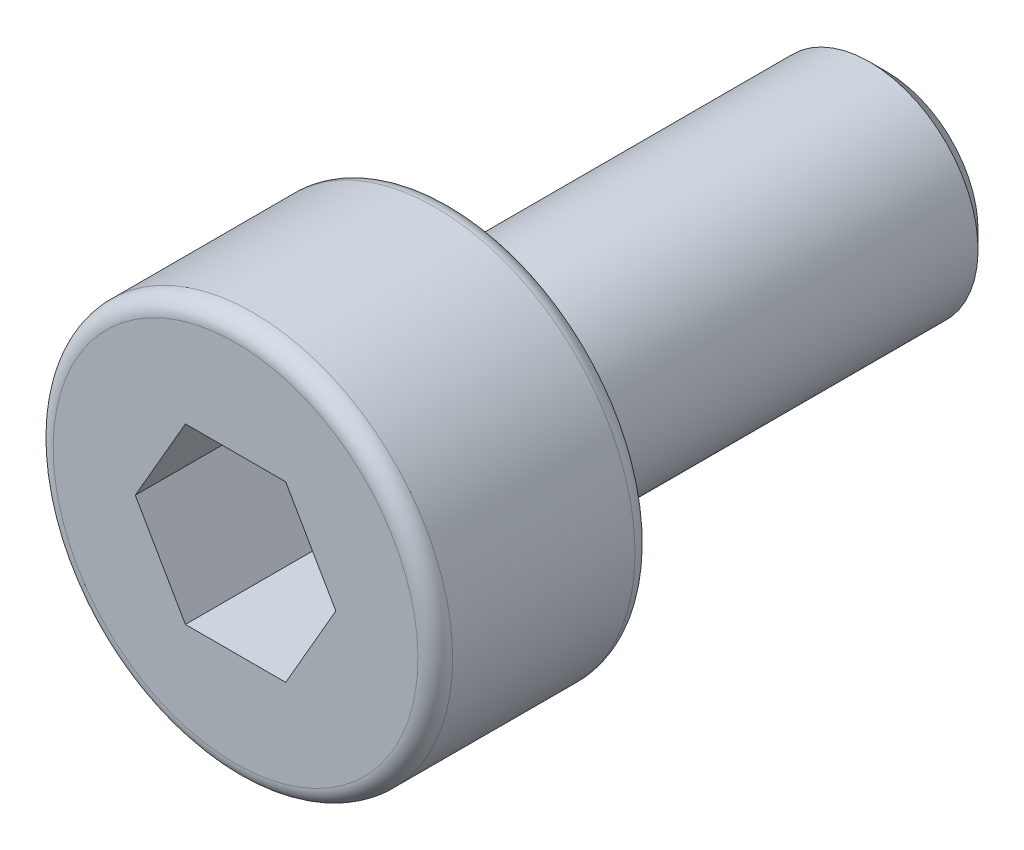
from build123d import *

# Parameters (mm, degrees)
FILLET_1_R          = 0.2
CHAMFER_1_SIZE      = 0.2
CUT_EXTRUDE_1_DEPTH = 1.5


with BuildPart() as part:
    # 草图2 → 旋转1 (revolve)
    with BuildSketch(Plane(origin=(0, 0, 0), x_dir=(0, 0, -1), z_dir=(1, 0, 0))):
        Polygon((0, 0), (0, 2.3), (2.5, 2.3), (2.5, 1.25), (7.5, 1.25), (7.5, 0), align=None)
    revolve(axis=Axis((0, 0, -7.5), (0, 0, 1)))

    # 圆角1
    fillet_1_edges = [part.edges().sort_by_distance(p)[0] for p in [
        (0, -2.3, -2.5),
        (0, -2.3, 0),
    ]]
    fillet(fillet_1_edges, radius=FILLET_1_R)

    # 倒角1
    chamfer_1_edges = [part.edges().sort_by_distance(p)[0] for p in [
        (0, -1.25, -7.5),
    ]]
    chamfer(chamfer_1_edges, length=CHAMFER_1_SIZE)

    # 草图3 → 切除-拉伸1 (cut)
    with BuildSketch(Plane.XY):
        Polygon((1.154700538, 0), (0.577350269, 1), (-0.577350269, 1), (-1.154700538, 0), (-0.577350269, -1), (0.577350269, -1), align=None)
    extrude(amount=-CUT_EXTRUDE_1_DEPTH, mode=Mode.SUBTRACT)


solid = part.part
